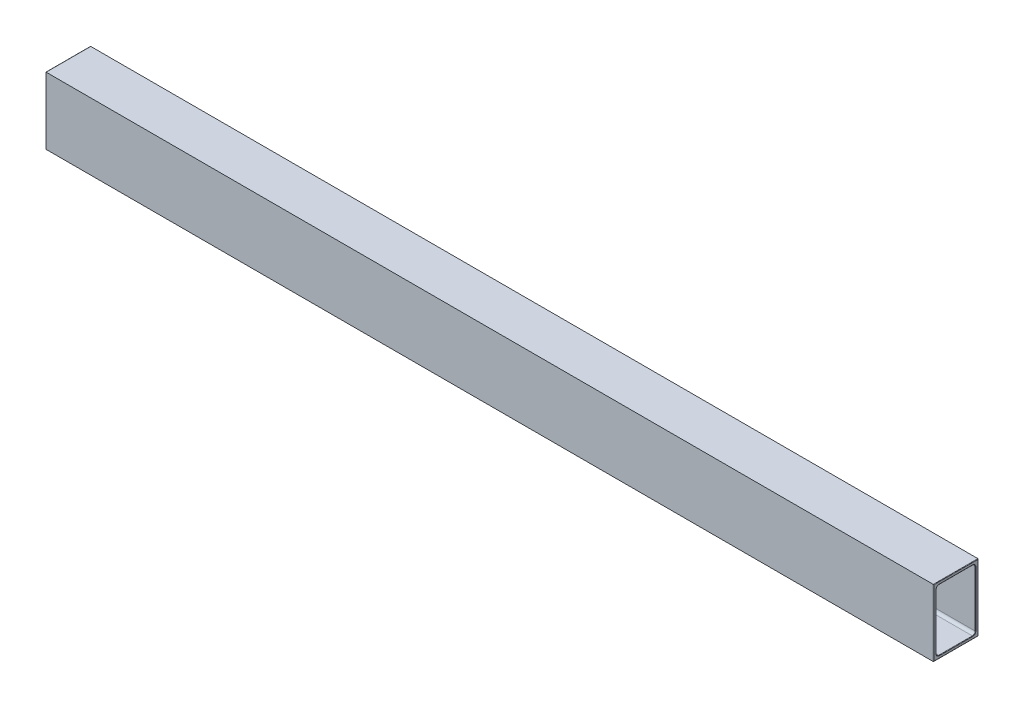
from build123d import *

# Parameters (mm, degrees)
SKETCH1_W           = 101.6
SKETCH1_H           = 152.4
BOSS_EXTRUDE1_DEPTH = 2022.623564854
FILLET1_R           = 1


with BuildPart() as part:
    # Sketch1 → Boss-Extrude1 (new body)
    with BuildSketch(Plane(origin=(0, 0, 0), x_dir=(0, 0, -1), z_dir=(1, 0, 0))):
        with Locations((-50.8, 76.2)):
            Rectangle(SKETCH1_W, SKETCH1_H)
        with BuildLine():
            Line((-95.25, 12.7), (-95.25, 139.7))
            ThreePointArc((-95.25, 139.7), (-93.390128061, 144.190128061), (-88.9, 146.05))
            Line((-88.9, 146.05), (-12.7, 146.05))
            ThreePointArc((-12.7, 146.05), (-8.209871939, 144.190128061), (-6.35, 139.7))
            Line((-6.35, 139.7), (-6.35, 12.7))
            ThreePointArc((-6.35, 12.7), (-8.209871939, 8.209871939), (-12.7, 6.35))
            Line((-12.7, 6.35), (-88.9, 6.35))
            ThreePointArc((-88.9, 6.35), (-93.390128061, 8.209871939), (-95.25, 12.7))
        make_face(mode=Mode.SUBTRACT)
    extrude(amount=BOSS_EXTRUDE1_DEPTH)

    # Fillet1
    fillet1_edges = [part.edges().sort_by_distance(p)[0] for p in [
        (2022.623564854, 76.2, 101.6),
        (2022.623564854, 0, 50.8),
        (0, 8.209871939, 93.390128061),
        (0, 6.35, 50.8),
        (0, 8.209871939, 8.209871939),
        (0, 76.2, 6.35),
        (0, 144.190128061, 8.209871939),
        (0, 146.05, 50.8),
        (0, 144.190128061, 93.390128061),
        (0, 76.2, 95.25),
        (2022.623564854, 8.209871939, 93.390128061),
        (2022.623564854, 6.35, 50.8),
        (2022.623564854, 8.209871939, 8.209871939),
        (2022.623564854, 76.2, 6.35),
        (2022.623564854, 144.190128061, 8.209871939),
        (2022.623564854, 146.05, 50.8),
        (2022.623564854, 144.190128061, 93.390128061),
        (2022.623564854, 76.2, 95.25),
        (2022.623564854, 76.2, 0),
        (0, 0, 50.8),
        (0, 76.2, 101.6),
        (0, 152.4, 50.8),
        (0, 76.2, 0),
        (2022.623564854, 152.4, 50.8),
    ]]
    fillet(fillet1_edges, radius=FILLET1_R)


solid = part.part
